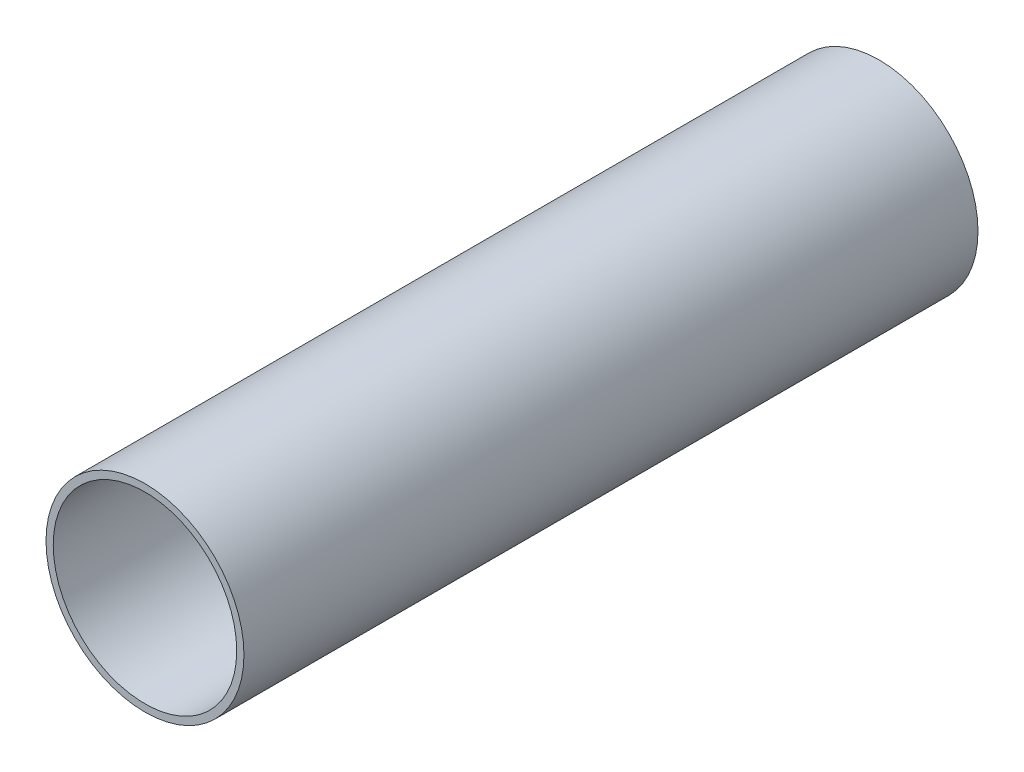
from build123d import *

# Parameters (mm, degrees)
SKETCH1_R           = 54.8
SKETCH1_R_2         = 50.8
BOSS_EXTRUDE1_DEPTH = 203.2


with BuildPart() as part:
    # Sketch1 → Boss-Extrude1 (new, symmetric)
    with BuildSketch(Plane.XY):
        Circle(SKETCH1_R)
        Circle(SKETCH1_R_2, mode=Mode.SUBTRACT)
    extrude(amount=BOSS_EXTRUDE1_DEPTH, both=True)


solid = part.part
